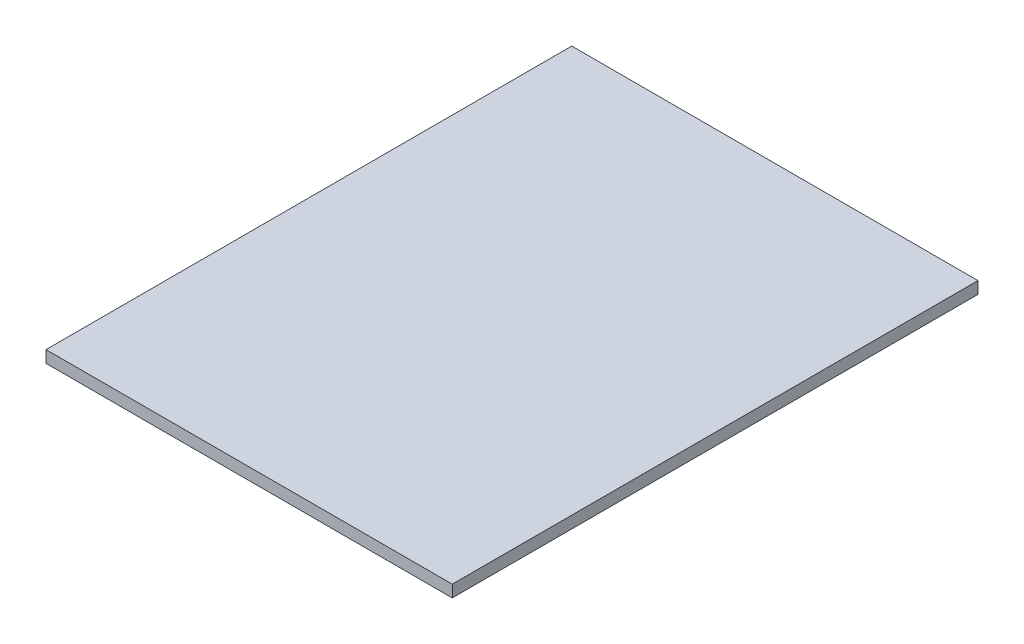
from build123d import *

# Parameters (mm, degrees)
SKETCH1_W           = 215.9
SKETCH1_H           = 279.4
BOSS_EXTRUDE1_DEPTH = 3.175


with BuildPart() as part:
    # Sketch1 → Boss-Extrude1 (new, symmetric)
    with BuildSketch(Plane(origin=(0, 0, 0), x_dir=(1, 0, 0), z_dir=(0, 1, 0))):
        Rectangle(SKETCH1_W, SKETCH1_H)
    extrude(amount=BOSS_EXTRUDE1_DEPTH, both=True)


solid = part.part
